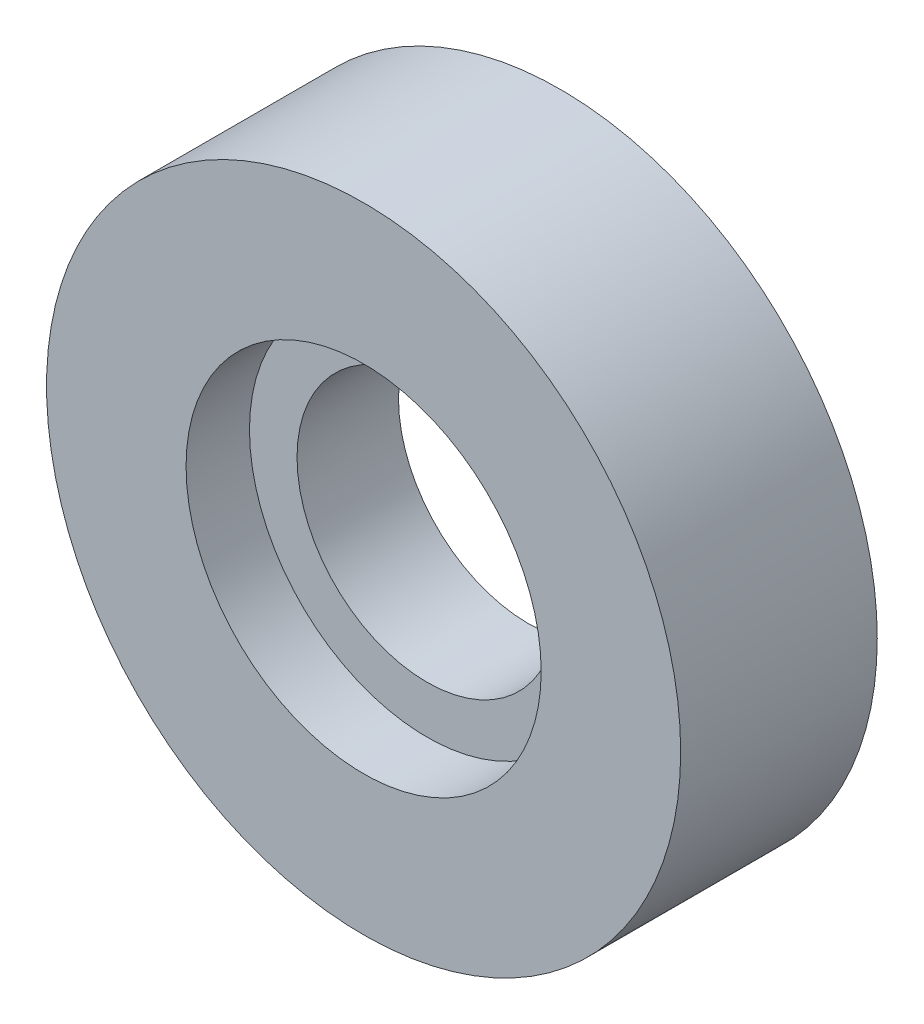
from build123d import *


with BuildPart() as part:
    # Sketch1 → Revolve1 (revolve)
    with BuildSketch(Plane(origin=(0, 0, 0), x_dir=(0, 0, -1), z_dir=(1, 0, 0)), mode=Mode.PRIVATE) as revolve1_sk:
        Polygon((31, 34), (31, 50), (0, 50), (0, 28), (10, 28), (10, 20.5), (26, 20.5), (26, 34), align=None)
    revolve(revolve1_sk.sketch.rotate(Axis((0, 0, 0), (0, 0, -1)), 90), axis=Axis((0, 0, 0), (0, 0, -1)))


solid = part.part
